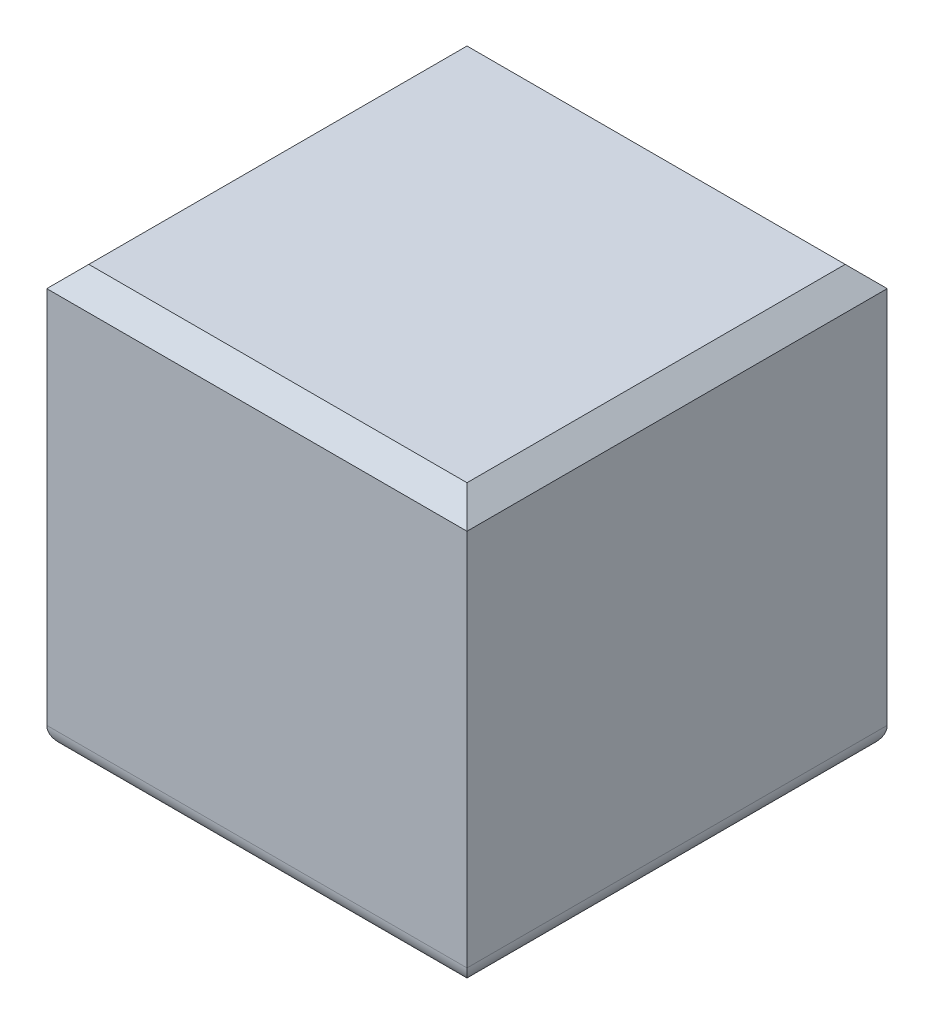
from build123d import *

# Parameters (mm, degrees)
SKETCH1_W           = 100
SKETCH1_H           = 100
BOSS_EXTRUDE1_DEPTH = 100
FILLET1_R           = 5
CHAMFER2_SIZE       = 5


with BuildPart() as part:
    # Sketch1 → Boss-Extrude1 (new body)
    with BuildSketch(Plane(origin=(0, 0, 0), x_dir=(1, 0, 0), z_dir=(0, 1, 0))):
        Rectangle(SKETCH1_W, SKETCH1_H)
    extrude(amount=BOSS_EXTRUDE1_DEPTH)

    # Fillet1
    fillet1_edges = [part.edges().sort_by_distance(p)[0] for p in [
        (0, 0, -50),
        (50, 0, 0),
        (0, 0, 50),
        (-50, 0, 0),
    ]]
    fillet(fillet1_edges, radius=FILLET1_R)

    # Chamfer2
    chamfer2_edges = [part.edges().sort_by_distance(p)[0] for p in [
        (50, 100, 0),
        (0, 100, -50),
        (-50, 100, 0),
        (0, 100, 50),
    ]]
    chamfer(chamfer2_edges, length=CHAMFER2_SIZE)


solid = part.part
